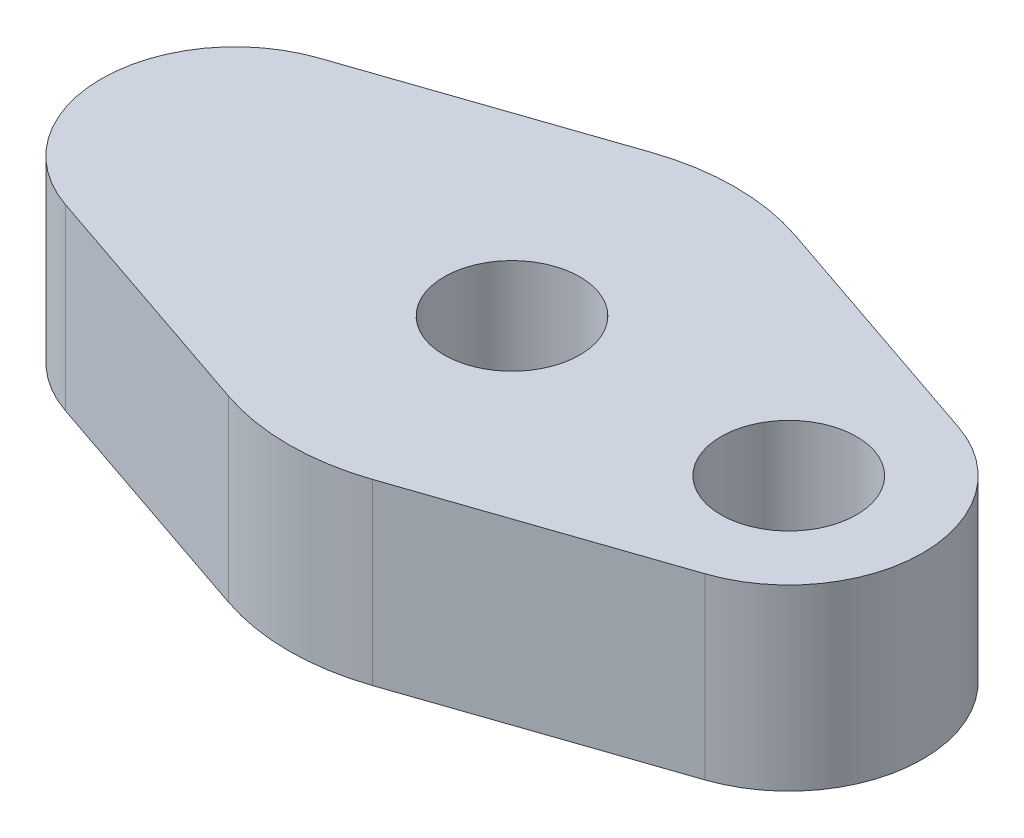
from build123d import *

# Parameters (mm, degrees)
SKETCH1_R             = 6.25
SKETCH1_R_2           = 3.75
SKETCH1_R_3           = 2.5
BOSS_EXTRUDE1_DEPTH   = 5
F_6_CLEARANCE_HOLE1_D = 3.7973


with BuildPart() as part:
    # Sketch1 → Boss-Extrude1 (new body)
    # profile 1 of 15: a face of its own
    with BuildSketch(Plane(origin=(0, 0, 0), x_dir=(1, 0, 0), z_dir=(0, 1, 0))):
        Circle(SKETCH1_R)
    # profile 2 of 15: a face of its own
    with BuildSketch(Plane(origin=(0, 0, 0), x_dir=(1, 0, 0), z_dir=(0, 1, 0))):
        with Locations((-7.75, 0)):
            Circle(SKETCH1_R_2)
        with Locations((-7.75, 0)):
            Circle(SKETCH1_R_3, mode=Mode.SUBTRACT)
    # profile 3 of 15: a face of its own
    with BuildSketch(Plane(origin=(0, 0, 0), x_dir=(1, 0, 0), z_dir=(0, 1, 0))):
        Circle(SKETCH1_R)
    # profile 4 of 15: a face of its own
    with BuildSketch(Plane(origin=(0, 0, 0), x_dir=(1, 0, 0), z_dir=(0, 1, 0))):
        with Locations((-7.75, 0)):
            Circle(SKETCH1_R_2)
        with Locations((-7.75, 0)):
            Circle(SKETCH1_R_3, mode=Mode.SUBTRACT)
    # profile 5 of 15: a face of its own
    with BuildSketch(Plane(origin=(0, 0, 0), x_dir=(1, 0, 0), z_dir=(0, 1, 0))):
        with Locations((7.75, 0)):
            Circle(SKETCH1_R_2)
    # profile 6 of 15: a face of its own
    with BuildSketch(Plane(origin=(0, 0, 0), x_dir=(1, 0, 0), z_dir=(0, 1, 0))):
        Circle(SKETCH1_R)
    # profile 7 of 15: a face of its own
    with BuildSketch(Plane(origin=(0, 0, 0), x_dir=(1, 0, 0), z_dir=(0, 1, 0))):
        with Locations((-7.75, 0)):
            Circle(SKETCH1_R_2)
    # profile 8 of 15: a face of its own
    with BuildSketch(Plane(origin=(0, 0, 0), x_dir=(1, 0, 0), z_dir=(0, 1, 0))):
        with BuildLine():
            ThreePointArc((-5.487903226, -2.990889196), (-7.15425073, -3.702375293), (-8.959677419, -3.54953244))
            Line((-8.959677419, -3.54953244), (-2.016129032, -5.9158874))
            ThreePointArc((-2.016129032, -5.9158874), (-4.026975125, -4.77974595), (-5.487903226, -2.990889196))
        make_face()
    # profile 9 of 15: a face of its own
    with BuildSketch(Plane(origin=(0, 0, 0), x_dir=(1, 0, 0), z_dir=(0, 1, 0))):
        with BuildLine():
            ThreePointArc((5.487903226, -2.990889196), (4.026975125, -4.77974595), (2.016129032, -5.9158874))
            Line((2.016129032, -5.9158874), (8.959677419, -3.54953244))
            ThreePointArc((8.959677419, -3.54953244), (7.15425073, -3.702375293), (5.487903226, -2.990889196))
        make_face()
    # profile 10 of 15: a face of its own
    with BuildSketch(Plane(origin=(0, 0, 0), x_dir=(1, 0, 0), z_dir=(0, 1, 0))):
        Circle(SKETCH1_R)
    # profile 11 of 15: a face of its own
    with BuildSketch(Plane(origin=(0, 0, 0), x_dir=(1, 0, 0), z_dir=(0, 1, 0))):
        with Locations((7.75, 0)):
            Circle(SKETCH1_R_2)
        with Locations((7.75, 0)):
            Circle(SKETCH1_R_3, mode=Mode.SUBTRACT)
    # profile 12 of 15: a face of its own
    with BuildSketch(Plane(origin=(0, 0, 0), x_dir=(1, 0, 0), z_dir=(0, 1, 0))):
        with Locations((7.75, 0)):
            Circle(SKETCH1_R_2)
        with Locations((7.75, 0)):
            Circle(SKETCH1_R_3, mode=Mode.SUBTRACT)
    # profile 13 of 15: a face of its own
    with BuildSketch(Plane(origin=(0, 0, 0), x_dir=(1, 0, 0), z_dir=(0, 1, 0))):
        Circle(SKETCH1_R)
    # profile 14 of 15: a face of its own
    with BuildSketch(Plane(origin=(0, 0, 0), x_dir=(1, 0, 0), z_dir=(0, 1, 0))):
        with BuildLine():
            Line((8.959677419, 3.54953244), (2.016129032, 5.9158874))
            ThreePointArc((2.016129032, 5.9158874), (4.026975125, 4.77974595), (5.487903226, 2.990889196))
            ThreePointArc((5.487903226, 2.990889196), (7.15425073, 3.702375293), (8.959677419, 3.54953244))
        make_face()
    # profile 15 of 15: a face of its own
    with BuildSketch(Plane(origin=(0, 0, 0), x_dir=(1, 0, 0), z_dir=(0, 1, 0))):
        with BuildLine():
            Line((-2.016129032, 5.9158874), (-8.959677419, 3.54953244))
            ThreePointArc((-8.959677419, 3.54953244), (-7.15425073, 3.702375293), (-5.487903226, 2.990889196))
            ThreePointArc((-5.487903226, 2.990889196), (-4.026975125, 4.77974595), (-2.016129032, 5.9158874))
        make_face()
    extrude(amount=BOSS_EXTRUDE1_DEPTH)

    # #6 Clearance Hole1 (through all)
    with Locations(Plane(origin=(0, 5, 0), x_dir=(1, 0, 0), z_dir=(0, 1, 0))):
        with Locations((7.75, 0), (0, 0)):
            Hole(F_6_CLEARANCE_HOLE1_D / 2)


solid = part.part
